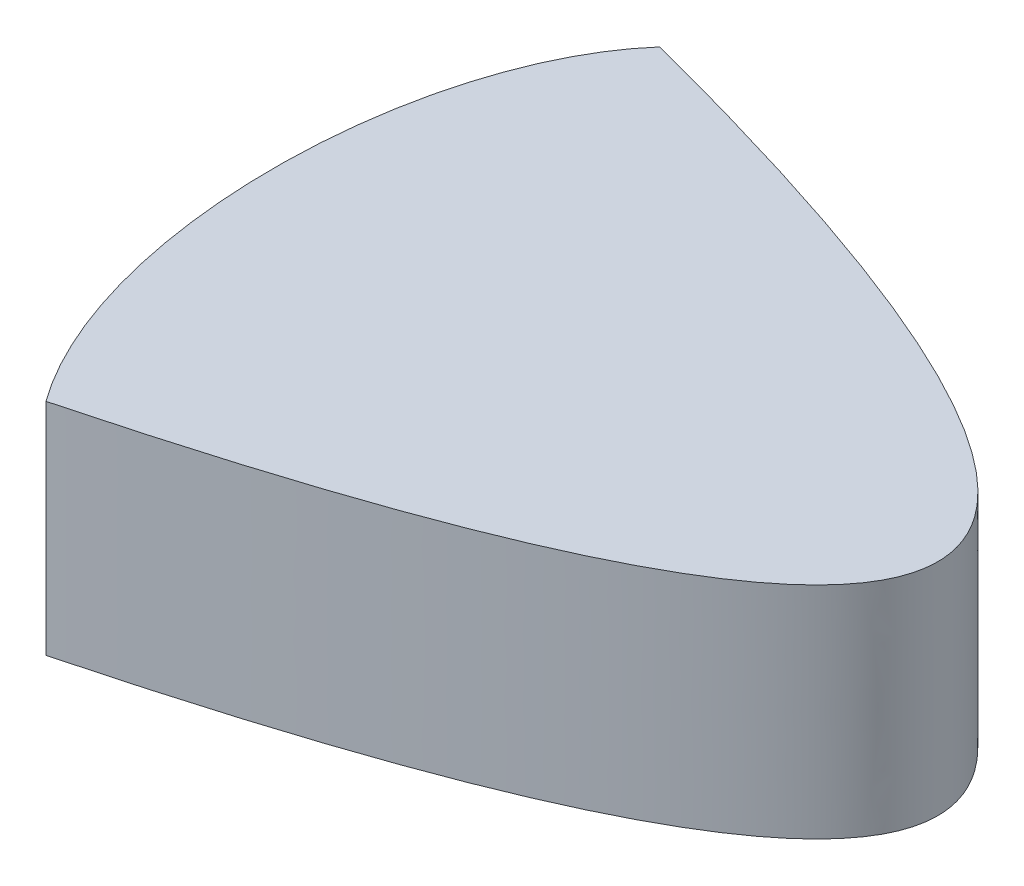
from build123d import *

# Parameters (mm, degrees)
BOSS_EXTRUDE1_DEPTH = 10
SKETCH5_W           = 190.665965361
SKETCH5_H           = 98.914857752
CUT_EXTRUDE2_DEPTH  = 131.512395512
SKETCH3_W           = 187.034733152
SKETCH3_H           = 91.693908175
CUT_EXTRUDE1_DEPTH  = 125.356356188


with BuildPart() as part:
    # Sketch2 → Boss-Extrude1 (new body)
    with BuildSketch(Plane(origin=(0, 0, 0), x_dir=(1, 0, 0), z_dir=(0, 1, 0))):
        with BuildLine():
            Line((-26, 24.3), (0, 24.3))
            add(Edge.make_bspline(
                [(0, 24.3), (20.683832289, 24.384713811), (29.8, 14.098961604), (29.8, 0)],
                knots=[0, 0, 0, 0, 1, 1, 1, 1], degree=3))
            add(Edge.make_bspline(
                [(29.8, 0), (29.8, -15.903385672), (12.793782652, -19.673675204), (0, -22.5)],
                knots=[0, 0, 0, 0, 1, 1, 1, 1], degree=3))
            add(Edge.make_bspline(
                [(-86.5, -27.9), (-58.742591927, -27.9), (0, -22.5)],
                knots=[0, 0, 0, 1, 1, 1], degree=2))
            add(Edge.make_bspline(
                [(-124.6, 11.6), (-126.645501882, -15.929564791), (-96.169164371, -28.458925346), (-86.5, -27.9)],
                knots=[0, 0, 0, 0, 1, 1, 1, 1], degree=3))
            add(Edge.make_bspline(
                [(-86.5, 37.2), (-111.583343569, 37.2), (-124.6, 21.145918181), (-124.6, 11.6)],
                knots=[0, 0, 0, 0, 1, 1, 1, 1], degree=3))
            add(Edge.make_bspline(
                [(-26, 24.3), (-46.37360759, 24.3), (-60.223367409, 37.2), (-86.5, 37.2)],
                knots=[0, 0, 0, 0, 1, 1, 1, 1], degree=3))
        make_face()
    extrude(amount=BOSS_EXTRUDE1_DEPTH)

    # Sketch5 → Cut-Extrude2 (cut, through all)
    with BuildSketch(Plane(origin=(0, 10, 0), x_dir=(1, 0, 0), z_dir=(0, 1, 0))):
        with Locations((-37.807166851, 5.712427693)):
            Rectangle(SKETCH5_W, SKETCH5_H)
        with BuildLine():
            Line((0, 19.3), (-26, 19.3))
            add(Edge.make_bspline(
                [(-26, 19.3), (-28.614389566, 19.3), (-31.195480065, 19.494126305), (-36.299918034, 20.219008193), (-38.823236595, 20.749932309), (-43.82844627, 22.053293526), (-46.31311575, 22.826190042), (-51.244397222, 24.470393512), (-53.69402913, 25.341112046), (-58.607069123, 27.040712597), (-61.070722849, 27.868848632), (-64.806301572, 28.989279687), (-66.059451522, 29.343006622), (-68.572193461, 29.996166113), (-69.832412317, 30.295833479), (-73.626302931, 31.102275727), (-76.173387066, 31.51524352), (-81.307214737, 32.063798503), (-83.893870441, 32.2), (-86.5, 32.2)],
                knots=[0, 0, 0, 0, 0.125, 0.125, 0.25, 0.25, 0.375, 0.375, 0.5, 0.5, 0.625, 0.625, 0.6875, 0.6875, 0.75, 0.75, 0.875, 0.875, 1, 1, 1, 1], degree=3))
            add(Edge.make_bspline(
                [(-86.5, 32.2), (-90.047671723, 32.2), (-93.539315109, 31.853363621), (-97.818101716, 30.88944061), (-98.669522164, 30.669824618), (-100.363040922, 30.17291839), (-101.207876089, 29.89460231), (-103.707194596, 28.9730152), (-105.314538731, 28.24898707), (-108.402461221, 26.564840966), (-109.885156962, 25.604040465), (-112.695415045, 23.412360835), (-113.989352092, 22.209304545), (-115.736354807, 20.217749989), (-116.286105675, 19.522480074), (-117.307591473, 18.056713662), (-117.771937921, 17.297113036), (-118.380597746, 16.112260348), (-118.568848857, 15.709499136), (-118.910400222, 14.885324985), (-119.063856456, 14.46298862), (-119.32099023, 13.612441675), (-119.425833719, 13.182501201), (-119.534502641, 12.528030347), (-119.56255262, 12.308265558), (-119.588853411, 11.975515189), (-119.594973106, 11.86407762), (-119.600932982, 11.639967141), (-119.6, 11.527142129), (-119.6, 11.414500659)],
                knots=[0, 0, 0, 0, 0.25, 0.25, 0.3125, 0.3125, 0.375, 0.375, 0.5, 0.5, 0.625, 0.625, 0.75, 0.75, 0.8125, 0.8125, 0.875, 0.875, 0.90625, 0.90625, 0.9375, 0.9375, 0.96875, 0.96875, 0.984375, 0.984375, 0.9921875, 0.9921875, 1, 1, 1, 1], degree=3))
            add(Edge.make_bspline(
                [(-119.6, 11.414500659), (-119.620469876, 11.139005048), (-119.640012507, 10.863585734), (-119.66949801, 10.313536999), (-119.702590259, 9.489380197), (-119.701746238, 8.668015761), (-119.653311171, 7.029133356), (-119.558725583, 5.941670929), (-119.316814989, 4.318708201), (-119.219497862, 3.779093122), (-118.990298597, 2.702707063), (-118.857842254, 2.164001324), (-118.411370332, 0.568296748), (-118.049576648, -0.466050211), (-117.204822005, -2.479103419), (-116.721870667, -3.457814087), (-115.911016092, -4.886192051), (-115.626316263, -5.355698602), (-115.028686616, -6.281748331), (-114.715117794, -6.739029825), (-113.098128241, -8.967198862), (-111.636582687, -10.586754888), (-109.243370012, -12.821144966), (-108.411754958, -13.533067597), (-107.116844881, -14.554870601), (-106.676456633, -14.888333255), (-105.787025552, -15.535321816), (-105.337421344, -15.84934205), (-103.066112758, -17.374312871), (-101.175798147, -18.452299517), (-98.237583629, -19.870168351), (-97.240844592, -20.309198302), (-95.209999189, -21.114841784), (-94.174615133, -21.48224539), (-92.064314636, -22.126795927), (-91.001033475, -22.402007075), (-89.387886633, -22.70933152), (-88.84713932, -22.794224632), (-88.028751145, -22.879499568), (-87.754740398, -22.90089357), (-87.340882626, -22.916536257), (-87.202453029, -22.918989427), (-86.924204685, -22.915854968), (-86.784006393, -22.908070411), (-86.64375233, -22.899963035)],
                knots=[0, 0, 0, 0, 0.015625, 0.015625, 0.03125, 0.0625, 0.0625, 0.125, 0.125, 0.15625, 0.15625, 0.1875, 0.1875, 0.25, 0.25, 0.3125, 0.3125, 0.34375, 0.34375, 0.375, 0.375, 0.5, 0.5, 0.5625, 0.5625, 0.59375, 0.59375, 0.625, 0.625, 0.75, 0.75, 0.8125, 0.8125, 0.875, 0.875, 0.9375, 0.9375, 0.96875, 0.96875, 0.984375, 0.984375, 0.9921875, 0.9921875, 1, 1, 1, 1], degree=3))
            add(Edge.make_bspline(
                [(-86.64375233, -22.899963035), (-83.051721737, -22.901813131), (-79.463866007, -22.836654879), (-72.292852573, -22.630933055), (-68.709770334, -22.489158228), (-57.965349536, -21.986375675), (-50.808741052, -21.549448214), (-36.50252062, -20.563295893), (-29.353030187, -20.012120654), (-15.058799553, -18.833526914), (-7.914092044, -18.205583695), (-0.771119947, -17.549786375)],
                knots=[0, 0, 0, 0, 0.125, 0.125, 0.25, 0.25, 0.5, 0.5, 0.75, 0.75, 1, 1, 1, 1], degree=3))
            add(Edge.make_bspline(
                [(-0.771119947, -17.549786375), (1.963321139, -16.94544861), (4.695341149, -16.33357579), (8.730024902, -15.218615637), (10.064478195, -14.814466089), (12.699729823, -13.90142355), (14.000796007, -13.393364173), (15.911888282, -12.505206219), (16.542091865, -12.187905528), (17.784402153, -11.496981701), (18.391917697, -11.125662576), (19.559410174, -10.32463286), (20.121164342, -9.894098151), (20.920538613, -9.18924898), (21.180682911, -8.943393186), (21.678462153, -8.434660622), (21.916135354, -8.171907904), (22.59259098, -7.356311131), (22.994745994, -6.776081028), (23.513123046, -5.842290056), (23.671822244, -5.519779327), (23.953566298, -4.86813842), (24.077688222, -4.537273262), (24.402854637, -3.53046254), (24.556745878, -2.840315617), (24.755950633, -1.42732092), (24.8, -0.714331591), (24.8, 0)],
                knots=[0, 0, 0, 0, 0.25, 0.25, 0.375, 0.375, 0.5, 0.5, 0.5625, 0.5625, 0.625, 0.625, 0.6875, 0.6875, 0.71875, 0.71875, 0.75, 0.75, 0.8125, 0.8125, 0.84375, 0.84375, 0.875, 0.875, 0.9375, 0.9375, 1, 1, 1, 1], degree=3))
            add(Edge.make_bspline(
                [(24.8, 0), (24.800001574, 1.499794527), (24.679867583, 2.978315628), (24.270262238, 5.1554747), (24.095205029, 5.874372955), (23.764785291, 6.940708409), (23.64330548, 7.294145508), (23.375491288, 7.996618496), (23.229208001, 8.345127218), (22.758435322, 9.365838107), (22.399931747, 10.019031745), (21.589242675, 11.268187742), (21.136243882, 11.865038785), (19.63468306, 13.559968632), (18.489202915, 14.513686307), (16.909680401, 15.525653475), (16.58535259, 15.719500417), (15.929822317, 16.085938782), (15.598164332, 16.258912353), (14.592578593, 16.74990385), (13.908081512, 17.040104299), (12.515293354, 17.557881638), (11.806985872, 17.785415353), (10.369782811, 18.186296846), (9.638661479, 18.360025682), (7.436633609, 18.806009812), (5.959001697, 19.004489088), (2.98950105, 19.255065786), (1.497532001, 19.3061318), (0, 19.3)],
                knots=[0, 0, 0, 0, 0.125, 0.125, 0.1875, 0.1875, 0.21875, 0.21875, 0.25, 0.25, 0.3125, 0.3125, 0.375, 0.375, 0.5, 0.5, 0.53125, 0.53125, 0.5625, 0.5625, 0.625, 0.625, 0.6875, 0.6875, 0.75, 0.75, 0.875, 0.875, 1, 1, 1, 1], degree=3))
        make_face(mode=Mode.SUBTRACT)
    extrude(amount=-CUT_EXTRUDE2_DEPTH, mode=Mode.SUBTRACT)

    # Sketch3 → Cut-Extrude1 (cut, through all)
    with BuildSketch(Plane(origin=(0, 10, 0), x_dir=(1, 0, 0), z_dir=(0, 1, 0))):
        with Locations((-46.850156507, 4.799176489)):
            Rectangle(SKETCH3_W, SKETCH3_H)
        with BuildLine():
            add(Edge.make_bspline(
                [(-86.5, -13.95), (-91.961767729, -6.422776523), (-91.717468637, 8.040517078), (-86.5, 13.95)],
                knots=[0, 0, 0, 0, 1, 1, 1, 1], degree=3))
            add(Edge.make_bspline(
                [(-86.5, 13.95), (-33.347412006, 0), (-86.5, -13.95)],
                knots=[0, 0, 0, 1, 1, 1], degree=2))
        make_face(mode=Mode.SUBTRACT)
    extrude(amount=-CUT_EXTRUDE1_DEPTH, mode=Mode.SUBTRACT)


solid = part.part
